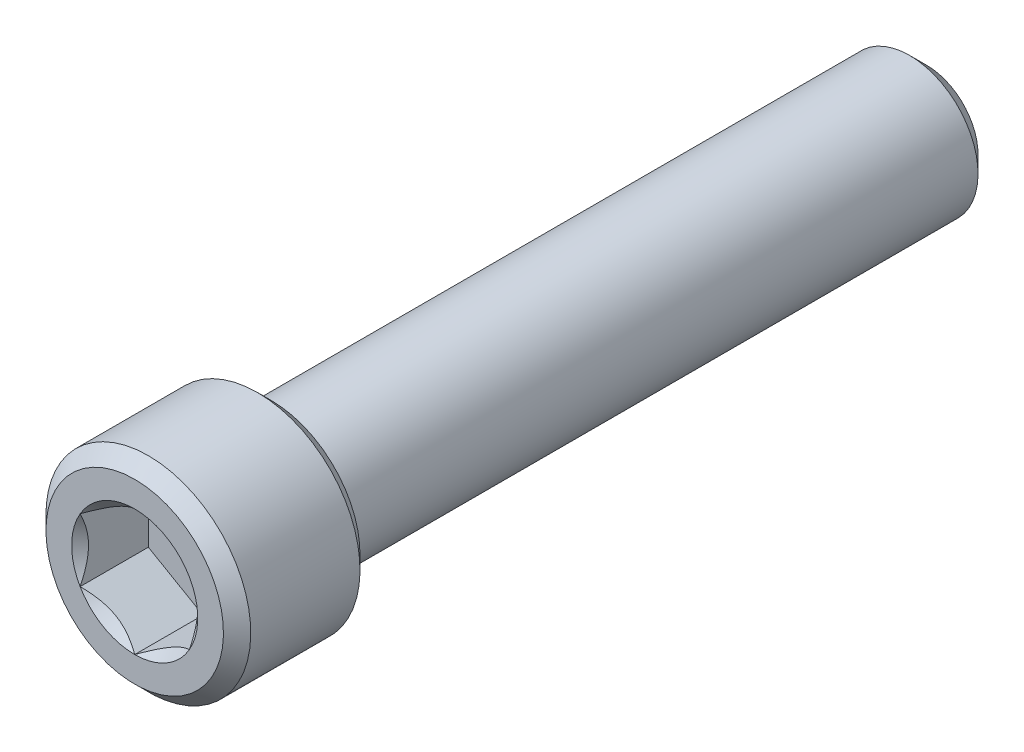
from build123d import *

# Parameters (mm, degrees)
CUT_EXTRUDE1_DEPTH = 3.96875


with BuildPart() as part:
    # Sketch3 → Revolve1 (revolve)
    with BuildSketch(Plane(origin=(0, 0, 0), x_dir=(0, 0, -1), z_dir=(1, 0, 0))):
        Polygon((23.01875, 0), (-23.01875, 0), (-23.01875, 5.159375), (-22.225, 5.953125), (-15.875, 5.953125), (-15.08125, 5.159375), (-15.08125, 3.9751), (22.030972222, 3.9751), (23.01875, 2.987322222), align=None)
    revolve(axis=Axis((0, 0, -23.01875), (0, 0, 1)))

    # Sketch4 → Cut-Extrude1 (cut)
    with BuildSketch(Plane.XY.offset(23.01875)):
        Polygon((0, -3.666174209), (3.175, -1.833087105), (3.175, 1.833087105), (0, 3.666174209), (-3.175, 1.833087105), (-3.175, -1.833087105), align=None)
    extrude(amount=-CUT_EXTRUDE1_DEPTH, mode=Mode.SUBTRACT)

    # Cut-Extrude3 cone 1 section (through the dimple's axis) → Cut-Extrude3 (revolve, cut)
    with BuildSketch(Plane(origin=(0, 0, 23.01875), x_dir=(0, -1, 0), z_dir=(1, 0, 0))):
        Polygon((0, 0), (3.666174209, 0), (0, 3.666174209), align=None)
    revolve(axis=Axis((0, 0, 23.01875), (0, 0, -1)), mode=Mode.SUBTRACT)


solid = part.part
